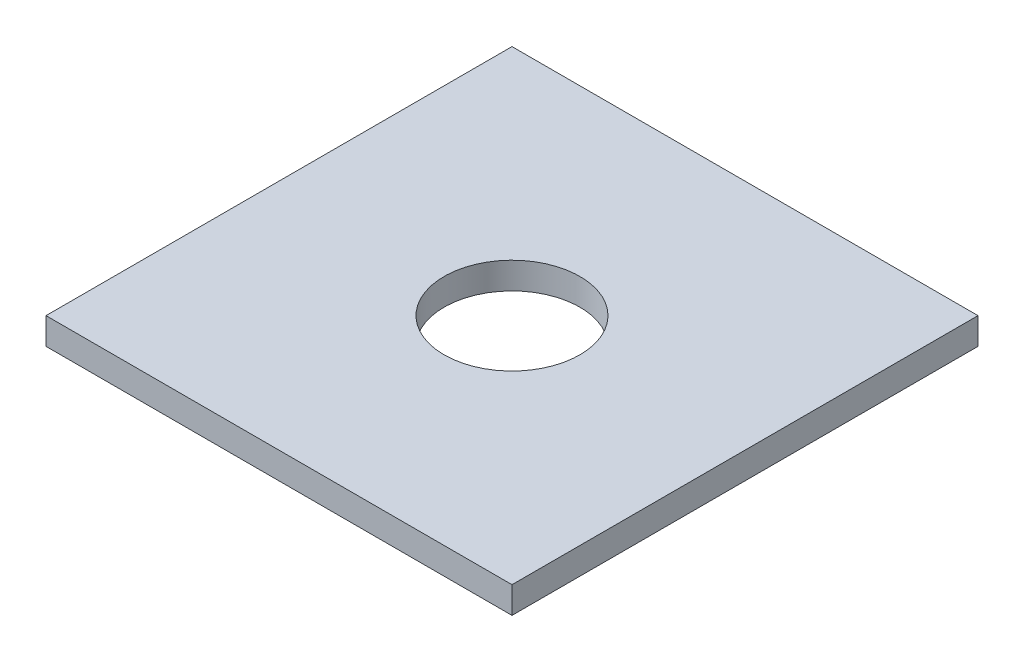
from build123d import *

# Parameters (mm, degrees)
SKETCH1_W           = 35
SKETCH1_H           = 35
BOSS_EXTRUDE1_DEPTH = 2
SKETCH2_R           = 5.1
CUT_EXTRUDE1_DEPTH  = 2


with BuildPart() as part:
    # Sketch1 → Boss-Extrude1 (new body)
    with BuildSketch(Plane(origin=(0, 0, 0), x_dir=(1, 0, 0), z_dir=(0, 1, 0))):
        Rectangle(SKETCH1_W, SKETCH1_H)
    extrude(amount=BOSS_EXTRUDE1_DEPTH)

    # Sketch2 → Cut-Extrude1 (cut)
    with BuildSketch(Plane(origin=(0, 2, 0), x_dir=(1, 0, 0), z_dir=(0, 1, 0))):
        Circle(SKETCH2_R)
    extrude(amount=-CUT_EXTRUDE1_DEPTH, mode=Mode.SUBTRACT)


solid = part.part
